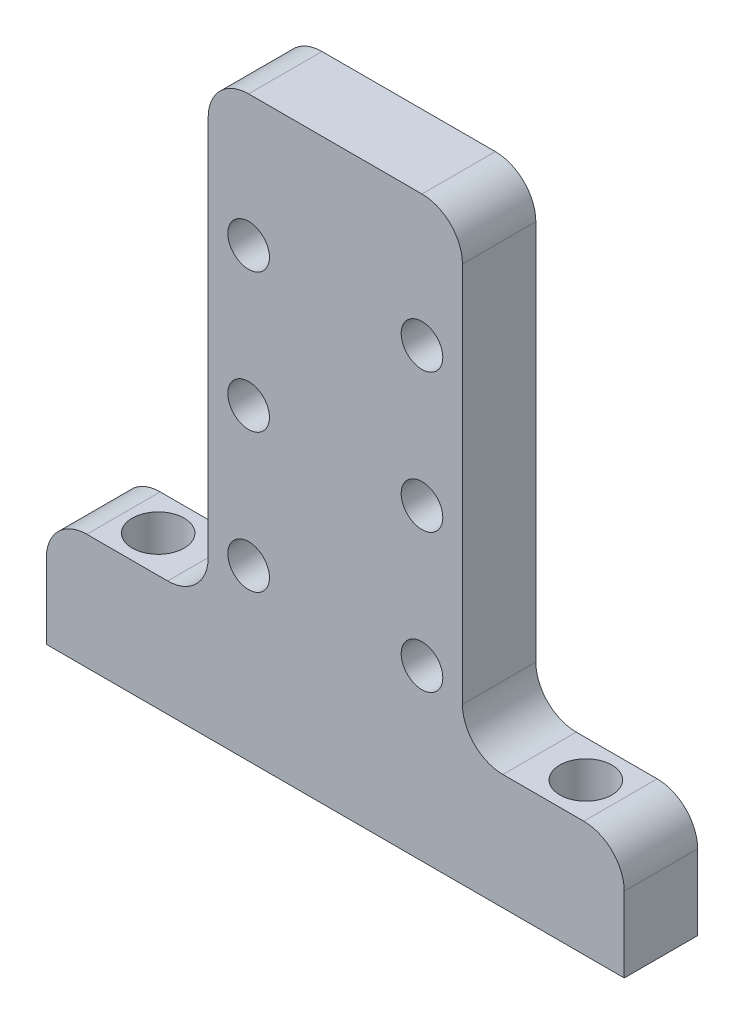
from build123d import *

# Parameters (mm, degrees)
BOSS_EXTRUDE1_DEPTH  = 6.35
M4_CLEARANCE_HOLE1_D = 4.5
M3_CLEARANCE_HOLE2_D = 3.6
FILLET1_R            = 3.5
FILLET2_R            = 3.5


with BuildPart() as part:
    # Sketch1 → Boss-Extrude1 (new body)
    with BuildSketch(Plane.XY):
        Polygon((-25, 0), (25, 0), (25, 10), (11, 10), (11, 50), (-11, 50), (-11, 10), (-25, 10), align=None)
    extrude(amount=BOSS_EXTRUDE1_DEPTH)

    # M4 Clearance Hole1 (through all)
    with Locations(Plane(origin=(0, 10, 0), x_dir=(1, 0, 0), z_dir=(0, 1, 0))):
        with Locations((-18.5, -3.175), (18.5, -3.175)):
            Hole(M4_CLEARANCE_HOLE1_D / 2)

    # M3 Clearance Hole2 (through all)
    with Locations(Plane.XY.offset(6.35)):
        with Locations((-7.5, 26.65), (7.5, 38.65), (-7.5, 14.65), (7.5, 26.65), (-7.5, 38.65), (7.5, 14.65)):
            Hole(M3_CLEARANCE_HOLE2_D / 2)

    # Fillet1
    fillet1_edges = [part.edges().sort_by_distance(p)[0] for p in [
        (-11, 10, 3.175),
        (11, 10, 3.175),
    ]]
    fillet(fillet1_edges, radius=FILLET1_R)

    # Fillet2
    fillet2_edges = [part.edges().sort_by_distance(p)[0] for p in [
        (-25, 10, 3.175),
        (-11, 50, 3.175),
        (11, 50, 3.175),
        (25, 10, 3.175),
    ]]
    fillet(fillet2_edges, radius=FILLET2_R)


solid = part.part
